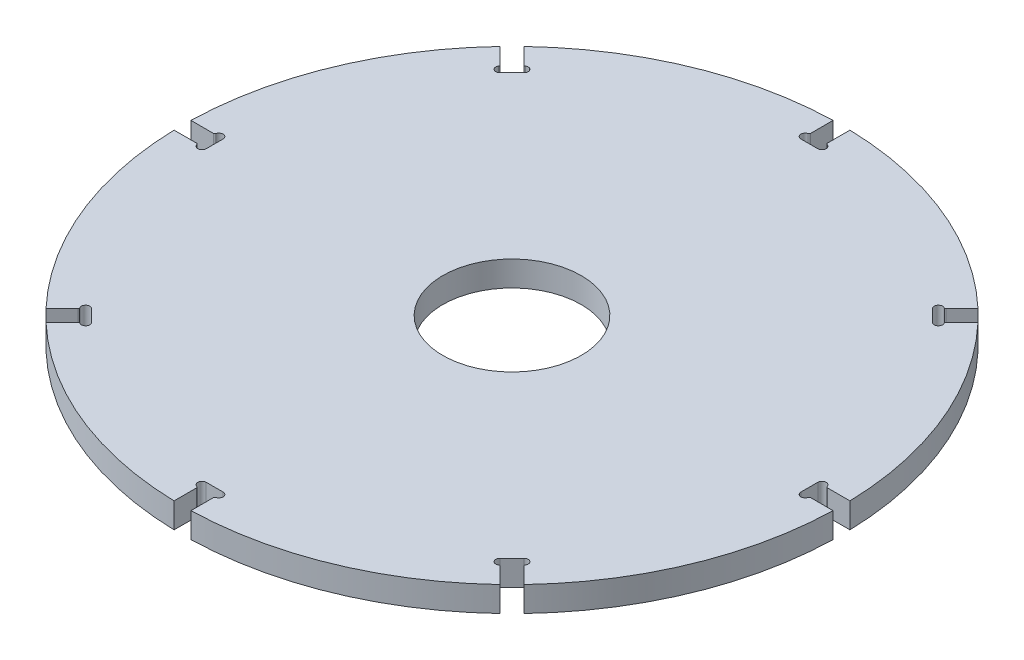
from build123d import *

# Parameters (mm, degrees)
SKETCH1_R                = 250
SKETCH1_R_2              = 52.5
BOSS_EXTRUDE1_DEPTH      = 19.05
CUT_EXTRUDE1_DEPTH       = 355.066240272
FILLET1_R                = 1
CIRPATTERN1_COUNT        = 8
FILLET1_OF_CIRPATTERN1_R = 1


with BuildPart() as part:
    # Sketch1 → Boss-Extrude1 (new body)
    with BuildSketch(Plane(origin=(0, 0, 0), x_dir=(1, 0, 0), z_dir=(0, 1, 0))):
        with Locations(Location((0, 0, 0), (0, 0, 90))):
            Circle(SKETCH1_R)
        with Locations(Location((0, 0, 0), (0, 0, 90))):
            Circle(SKETCH1_R_2, mode=Mode.SUBTRACT)
    extrude(amount=BOSS_EXTRUDE1_DEPTH)

    # Sketch2 → Cut-Extrude1 (cut, through all)
    with BuildSketch(Plane(origin=(0, 19.05, 0), x_dir=(1, 0, 0), z_dir=(0, 1, 0))):
        with BuildLine():
            Line((6.4, 225.5), (-6.4, 225.5))
            ThreePointArc((-6.4, 225.5), (-9.6, 228.7), (-6.4, 231.9))
            Line((-6.4, 231.9), (-6.4, 250))
            Line((-6.4, 250), (6.4, 250))
            Line((6.4, 250), (6.4, 231.9))
            ThreePointArc((6.4, 231.9), (9.6, 228.7), (6.4, 225.5))
        make_face()
    cut_extrude1 = extrude(amount=-CUT_EXTRUDE1_DEPTH, mode=Mode.SUBTRACT)

    # Fillet1
    fillet1_edges = [part.edges().sort_by_distance(p)[0] for p in [
        (-6.4, 9.525, -231.9),
        (6.4, 9.525, -231.9),
    ]]
    fillet(fillet1_edges, radius=FILLET1_R)

    # CirPattern1: Cut-Extrude1 ×8 about axis
    cirpattern1_axis = Axis((0, 0, 0), (0, 1, 0))
    for i in range(1, CIRPATTERN1_COUNT):
        add(cut_extrude1.rotate(cirpattern1_axis, i * 360 / CIRPATTERN1_COUNT), mode=Mode.SUBTRACT)

    # Fillet1 of CirPattern1
    fillet1_of_cirpattern1_edges = [part.edges().sort_by_distance(p)[0] for p in [
        (-168.503545957, 9.525, -159.452579158),
        (-159.452579158, 9.525, -168.503545957),
        (-231.9, 9.525, 6.4),
        (-231.9, 9.525, -6.4),
        (-159.452579158, 9.525, 168.503545957),
        (-168.503545957, 9.525, 159.452579158),
        (6.4, 9.525, 231.9),
        (-6.4, 9.525, 231.9),
        (168.503545957, 9.525, 159.452579158),
        (159.452579158, 9.525, 168.503545957),
        (231.9, 9.525, -6.4),
        (231.9, 9.525, 6.4),
        (159.452579158, 9.525, -168.503545957),
        (168.503545957, 9.525, -159.452579158),
    ]]
    fillet(fillet1_of_cirpattern1_edges, radius=FILLET1_OF_CIRPATTERN1_R)


solid = part.part
